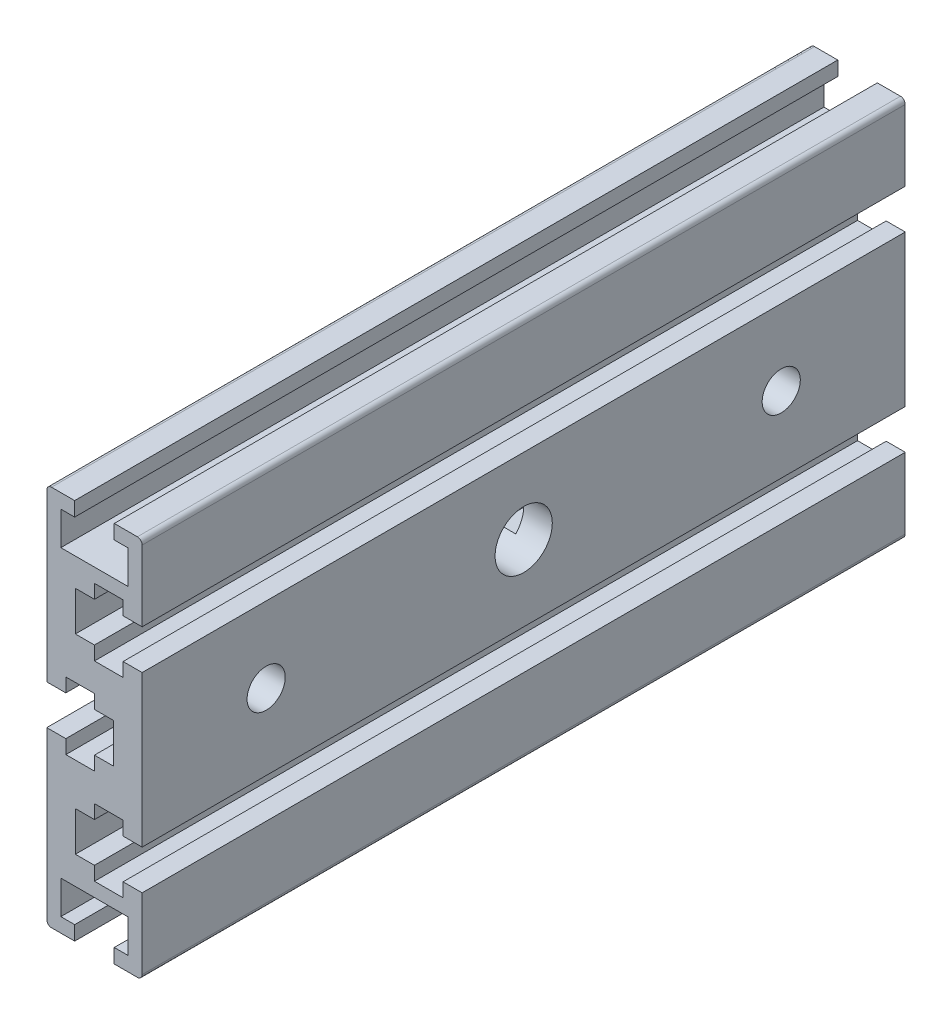
from build123d import *

# Parameters (mm, degrees)
EXTRUDE_1_DEPTH           = 160
HOLE_WIZARD_8_0_8_1_D     = 8
HOLE_WIZARD_8_0_8_2_D     = 8
HOLE_WIZARD_8_0_8_2_DEPTH = 8
HOLE_WIZARD_8_0_8_2_TIP   = 2.403442476
HOLE_WIZARD_12_0_12_2_D   = 12


with BuildPart() as part:
    # Sketch1 → 凸台-拉伸1 (new body)
    with BuildSketch(Plane.XY):
        with BuildLine():
            Line((-9, 40), (-4.15, 40))
            Line((-4.15, 40), (-4.15, 37))
            Line((-4.15, 37), (-7.05, 37))
            Line((-7.05, 37), (-7.05, 30))
            Line((-7.05, 30), (7.05, 30))
            Line((7.05, 30), (7.05, 37))
            Line((7.05, 37), (4.15, 37))
            Line((4.15, 37), (4.15, 40))
            Line((4.15, 40), (9, 40))
            ThreePointArc((9, 40), (9.707106781, 39.707106781), (10, 39))
            Line((10, 39), (10, 24.15))
            Line((10, 24.15), (6, 24.15))
            Line((6, 24.15), (6, 27.05))
            Line((6, 27.05), (0, 27.05))
            Line((0, 27.05), (0, 24.15))
            Line((0, 24.15), (-4, 24.15))
            Line((-4, 24.15), (-4, 15.85))
            Line((-4, 15.85), (0, 15.85))
            Line((0, 15.85), (0, 12.95))
            Line((0, 12.95), (6, 12.95))
            Line((6, 12.95), (6, 15.85))
            Line((6, 15.85), (10, 15.85))
            Line((10, 15.85), (10, -15.85))
            Line((10, -15.85), (6, -15.85))
            Line((6, -15.85), (6, -12.95))
            Line((6, -12.95), (0, -12.95))
            Line((0, -12.95), (0, -15.85))
            Line((0, -15.85), (-4, -15.85))
            Line((-4, -15.85), (-4, -24.15))
            Line((-4, -24.15), (0, -24.15))
            Line((0, -24.15), (0, -27.05))
            Line((0, -27.05), (6, -27.05))
            Line((6, -27.05), (6, -24.15))
            Line((6, -24.15), (10, -24.15))
            Line((10, -24.15), (10, -39))
            ThreePointArc((10, -39), (9.707106781, -39.707106781), (9, -40))
            Line((9, -40), (4.15, -40))
            Line((4.15, -40), (4.15, -37))
            Line((4.15, -37), (7.05, -37))
            Line((7.05, -37), (7.05, -30))
            Line((7.05, -30), (-7.05, -30))
            Line((-7.05, -30), (-7.05, -37))
            Line((-7.05, -37), (-4.15, -37))
            Line((-4.15, -37), (-4.15, -40))
            Line((-4.15, -40), (-9, -40))
            ThreePointArc((-9, -40), (-9.707106781, -39.707106781), (-10, -39))
            Line((-10, -39), (-10, -4.15))
            Line((-10, -4.15), (-6, -4.15))
            Line((-6, -4.15), (-6, -7.05))
            Line((-6, -7.05), (0, -7.05))
            Line((0, -7.05), (0, -4.15))
            Line((0, -4.15), (4, -4.15))
            Line((4, -4.15), (4, 4.15))
            Line((4, 4.15), (0, 4.15))
            Line((0, 4.15), (0, 7.05))
            Line((0, 7.05), (-6, 7.05))
            Line((-6, 7.05), (-6, 4.15))
            Line((-6, 4.15), (-10, 4.15))
            Line((-10, 4.15), (-10, 39))
            ThreePointArc((-10, 39), (-9.707106781, 39.707106781), (-9, 40))
        make_face()
    extrude(amount=EXTRUDE_1_DEPTH)

    # Ø8.0 (8) 直径孔1 (through all)
    with Locations(Plane(origin=(10, 0, 0), x_dir=(0, 0, -1), z_dir=(1, 0, 0))):
        with Locations((-134, 0)):
            Hole(HOLE_WIZARD_8_0_8_1_D / 2)

    # Ø8.0 (8) 直径孔2
    with Locations(Plane(origin=(10, 0, 0), x_dir=(0, 0, -1), z_dir=(1, 0, 0))):
        with Locations((-26, 0)):
            Hole(HOLE_WIZARD_8_0_8_2_D / 2, depth=HOLE_WIZARD_8_0_8_2_DEPTH)
            with Locations((0, 0, -(HOLE_WIZARD_8_0_8_2_DEPTH + HOLE_WIZARD_8_0_8_2_TIP / 2))):  # 118° drill point
                Cone(0, HOLE_WIZARD_8_0_8_2_D / 2, HOLE_WIZARD_8_0_8_2_TIP, mode=Mode.SUBTRACT)

    # Ø12.0 (12) 直径孔2 (through all)
    with Locations(Plane(origin=(10, 0, 0), x_dir=(0, 0, -1), z_dir=(1, 0, 0))):
        with Locations((-80, 0)):
            Hole(HOLE_WIZARD_12_0_12_2_D / 2)


solid = part.part
